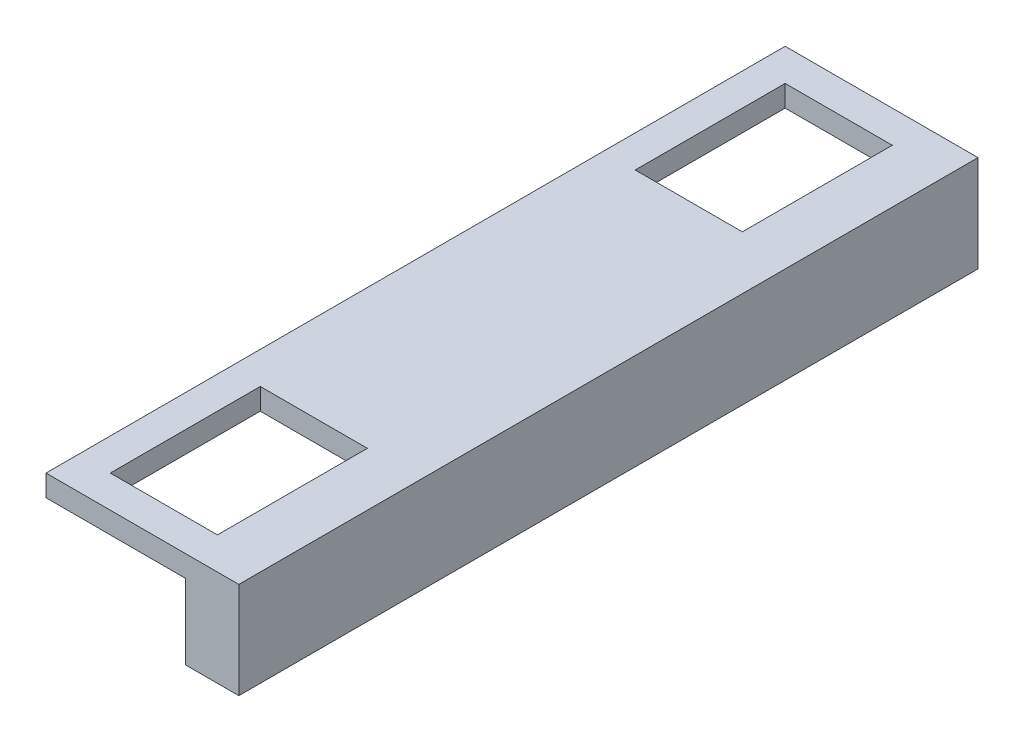
from build123d import *

# Parameters (mm, degrees)
BOSS_EXTRUDE1_DEPTH = 69
SKETCH2_W           = 69
SKETCH2_H           = 2
BOSS_EXTRUDE2_DEPTH = 3
SKETCH3_W           = 5
SKETCH3_H           = 7
BOSS_EXTRUDE4_DEPTH = 13
SKETCH5_R           = 1.5
BOSS_EXTRUDE5_DEPTH = 3
SKETCH8_W           = 10
SKETCH8_H           = 14
CUT_EXTRUDE1_DEPTH  = 71.372224634
CUT_EXTRUDE2_DEPTH  = 3


with BuildPart() as part:
    # Sketch1 → Boss-Extrude1 (new body)
    with BuildSketch(Plane.XY):
        Polygon((2.5, 1), (2.5, 8), (-7.5, 8), (-7.5, 10), (7.5, 10), (7.5, 1), align=None)
    extrude(amount=-BOSS_EXTRUDE1_DEPTH)

    # Sketch2 → Boss-Extrude2 (add)
    with BuildSketch(Plane.ZY.offset(7.5)):
        with Locations((-34.5, 9)):
            Rectangle(SKETCH2_W, SKETCH2_H)
    extrude(amount=BOSS_EXTRUDE2_DEPTH)

    # Sketch3 → Boss-Extrude4 (add)
    with BuildSketch(Plane.ZY.offset(-2.5)):
        with Locations((-34.5, 4.5)):
            Rectangle(SKETCH3_W, SKETCH3_H)
    extrude(amount=BOSS_EXTRUDE4_DEPTH)

    # Sketch5 → Boss-Extrude5 (add)
    with BuildSketch(Plane.XY.offset(-32)):
        with Locations(Location((-2.5, 4.5, 0), (0, 0, 180))):
            Circle(SKETCH5_R)
    boss_extrude5 = extrude(amount=BOSS_EXTRUDE5_DEPTH)

    # Sketch8 → Cut-Extrude1 (cut, through all)
    with BuildSketch(Plane(origin=(0, 10, 0), x_dir=(1, 0, 0), z_dir=(0, 1, 0))):
        with Locations((-2.5, 10)):
            Rectangle(SKETCH8_W, SKETCH8_H)
    cut_extrude1 = extrude(amount=-CUT_EXTRUDE1_DEPTH, mode=Mode.SUBTRACT)

    # Mirror1: Boss-Extrude5, Cut-Extrude1 across plane
    add(boss_extrude5.mirror(Plane.XY.offset(-34.5)))
    add(cut_extrude1.mirror(Plane.XY.offset(-34.5)), mode=Mode.SUBTRACT)

    # Sketch9 → Cut-Extrude2 (cut)
    with BuildSketch(Plane.XZ.offset(-1)):
        with BuildLine():
            Line((6.6, -24.5), (6.6, -44.5))
            ThreePointArc((6.6, -44.5), (5, -46.1), (3.4, -44.5))
            Line((3.4, -44.5), (3.4, -24.5))
            ThreePointArc((3.4, -24.5), (5, -22.9), (6.6, -24.5))
        make_face()
    extrude(amount=-CUT_EXTRUDE2_DEPTH, mode=Mode.SUBTRACT)


solid = part.part
